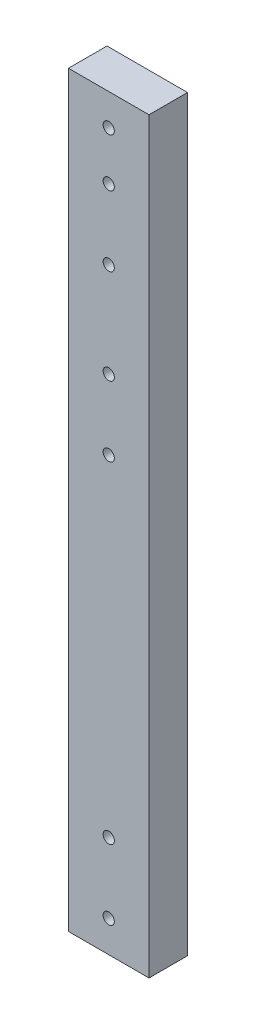
from build123d import *

# Parameters (mm, degrees)
SKETCH_1_W      = 23
SKETCH_1_H      = 213.5
SKETCH_1_R      = 1.6
EXTRUDE_1_DEPTH = 4
SKETCH_2_W      = 23
SKETCH_2_H      = 213.5
SKETCH_2_W_2    = 15.3
SKETCH_2_H_2    = 205.8
EXTRUDE_2_DEPTH = 7
CHAMFER_1_SIZE  = 2


with BuildPart() as part:
    # ｽｹｯﾁ1 → ﾎﾞｽ - 押し出し1 (new body)
    with BuildSketch(Plane.XY.offset(5)):
        with Locations((0, -7.25)):
            Rectangle(SKETCH_1_W, SKETCH_1_H)
        with Locations((0, -105)):
            Circle(SKETCH_1_R, mode=Mode.SUBTRACT)
        with Locations((0, -85)):
            Circle(SKETCH_1_R, mode=Mode.SUBTRACT)
        with Locations((0, 90.5)):
            Circle(SKETCH_1_R, mode=Mode.SUBTRACT)
        with Locations((0, 76.66)):
            Circle(SKETCH_1_R, mode=Mode.SUBTRACT)
        with Locations((0, 56.66)):
            Circle(SKETCH_1_R, mode=Mode.SUBTRACT)
        with Locations((0, 29.6)):
            Circle(SKETCH_1_R, mode=Mode.SUBTRACT)
        with Locations((0, 9.6)):
            Circle(SKETCH_1_R, mode=Mode.SUBTRACT)
    extrude(amount=EXTRUDE_1_DEPTH)

    # ｽｹｯﾁ2 → ﾎﾞｽ - 押し出し2 (add)
    with BuildSketch(Plane(origin=(0, 0, 5), x_dir=(-1, 0, 0), z_dir=(0, 0, -1))):
        with Locations((0, -7.25)):
            Rectangle(SKETCH_2_W, SKETCH_2_H)
        with Locations((0, -7.25)):
            Rectangle(SKETCH_2_W_2, SKETCH_2_H_2, mode=Mode.SUBTRACT)
    extrude(amount=EXTRUDE_2_DEPTH)

    # 面取り1
    chamfer_1_edges = [part.edges().sort_by_distance(p)[0] for p in [
        (0, -110.15, -2),
        (-7.65, -7.25, -2),
        (0, 95.65, -2),
        (7.65, -7.25, -2),
    ]]
    chamfer(chamfer_1_edges, length=CHAMFER_1_SIZE)


solid = part.part
